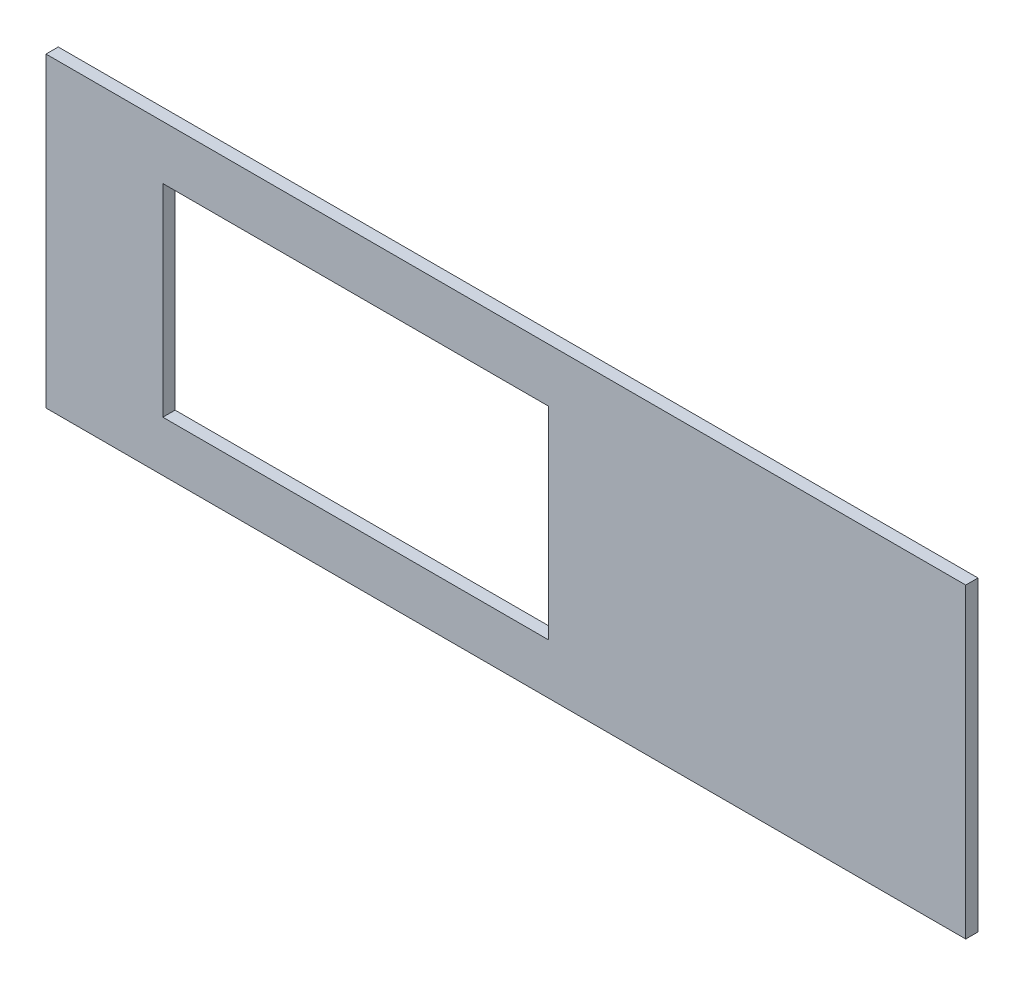
from build123d import *

# Parameters (mm, degrees)
SKETCH1_W           = 900
SKETCH1_H           = 300
SKETCH1_W_2         = 377.467011014
SKETCH1_H_2         = 198.040783713
BOSS_EXTRUDE2_DEPTH = 12


with BuildPart() as part:
    # Sketch1 → Boss-Extrude2 (new body)
    with BuildSketch(Plane.XY):
        with Locations((97.346938776, 150)):
            Rectangle(SKETCH1_W, SKETCH1_H)
        with Locations((-49.583422145, 148.423616523)):
            Rectangle(SKETCH1_W_2, SKETCH1_H_2, mode=Mode.SUBTRACT)
    extrude(amount=-BOSS_EXTRUDE2_DEPTH)


solid = part.part
